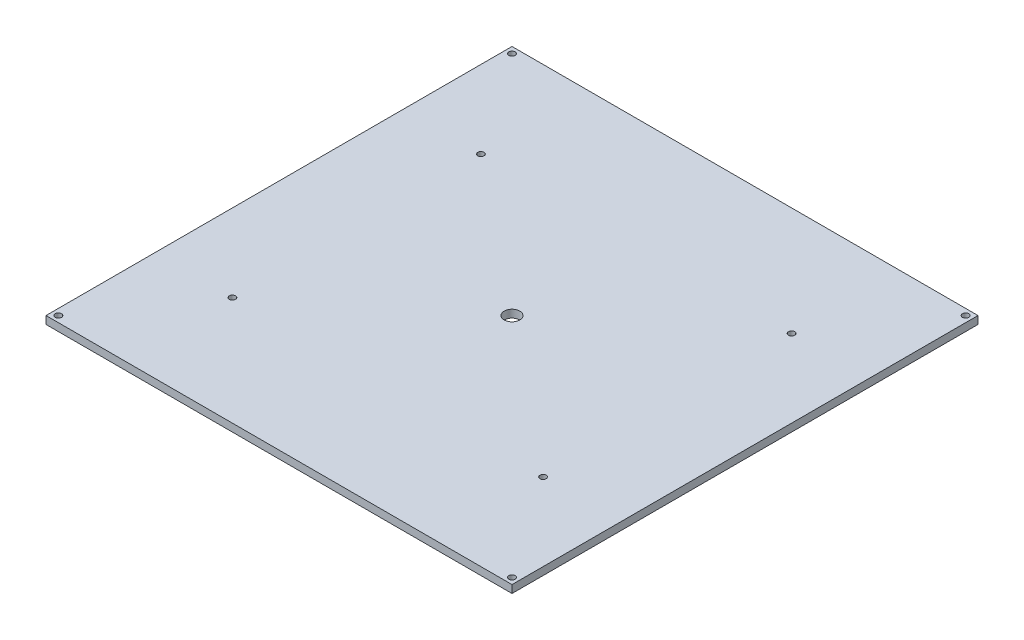
from build123d import *

# Parameters (mm, degrees)
SKETCH1_W                                  = 300
SKETCH1_H                                  = 300
BOSS_EXTRUDE1_DEPTH                        = 5
CUT_EXTRUDE1_REACH                         = 214.191
SKETCH2_R                                  = 2.05
MIRROR1_AT_THE_SECOND_PLANE_COPY_1_REACH   = 214.191
MIRROR1_AT_THE_SECOND_PLANE_COPY_1_SKETC_R = 2.05
CUT_EXTRUDE2_REACH                         = 214.191
SKETCH3_R                                  = 2
SKETCH3_R_2                                = 5


with BuildPart() as part:
    # Sketch1 → Boss-Extrude1 (new body)
    with BuildSketch(Plane(origin=(0, 0, 0), x_dir=(1, 0, 0), z_dir=(0, 1, 0))):
        Rectangle(SKETCH1_W, SKETCH1_H)
    extrude(amount=BOSS_EXTRUDE1_DEPTH)

    # Sketch2 → Cut-Extrude1 (cut, up to next)
    with BuildSketch(Plane(origin=(0, 5, 0), x_dir=(1, 0, 0), z_dir=(0, 1, 0)), mode=Mode.PRIVATE) as cut_extrude1_sk1:
        with Locations(Location((-146, 146, 0), (0, 0, 270))):
            Circle(SKETCH2_R)
    cut_extrude1_tool1 = extrude(cut_extrude1_sk1.sketch, amount=-CUT_EXTRUDE1_REACH, mode=Mode.PRIVATE) & part.part
    cut_extrude1 = cut_extrude1_tool1.solids().sort_by_distance((-146, 5, -146))[0]
    add(cut_extrude1, mode=Mode.SUBTRACT)

    # Mirror1: Cut-Extrude1 across plane
    add(cut_extrude1.mirror(Plane(origin=(0, 0, 0), x_dir=(0, 0, 1), z_dir=(1, 0, 0))), mode=Mode.SUBTRACT)

    # Mirror1 at the second plane: Cut-Extrude1 across plane
    add(cut_extrude1.mirror(Plane.XY), mode=Mode.SUBTRACT)

    # Mirror1 at the second plane copy 1 sketc → Mirror1 at the second plane copy 1 (cut, up to next)
    with BuildSketch(Plane(origin=(0, 5, 0), x_dir=(-1, 0, 0), z_dir=(0, 1, 0)), mode=Mode.PRIVATE) as mirror1_at_the_second_plane_copy_1_sk1:
        with Locations(Location((-146, 146, 0), (0, 0, 270))):
            Circle(MIRROR1_AT_THE_SECOND_PLANE_COPY_1_SKETC_R)
    mirror1_at_the_second_plane_copy_1_tool1 = extrude(mirror1_at_the_second_plane_copy_1_sk1.sketch, amount=-MIRROR1_AT_THE_SECOND_PLANE_COPY_1_REACH, mode=Mode.PRIVATE) & part.part
    add(mirror1_at_the_second_plane_copy_1_tool1.solids().sort_by_distance((146, 5, 146))[0], mode=Mode.SUBTRACT)

    # Sketch3 → Cut-Extrude2 (cut, up to next)
    with BuildSketch(Plane(origin=(0, 5, 0), x_dir=(1, 0, 0), z_dir=(0, 1, 0)), mode=Mode.PRIVATE) as cut_extrude2_sk1:
        with Locations(Location((-100, 80, 0), (0, 0, 270))):
            Circle(SKETCH3_R)
    cut_extrude2_tool1 = extrude(cut_extrude2_sk1.sketch, amount=-CUT_EXTRUDE2_REACH, mode=Mode.PRIVATE) & part.part
    # Sketch3 → Cut-Extrude2 (cut, up to next)
    with BuildSketch(Plane(origin=(0, 5, 0), x_dir=(1, 0, 0), z_dir=(0, 1, 0)), mode=Mode.PRIVATE) as cut_extrude2_sk2:
        with Locations(Location((100, 80, 0), (0, 0, 270))):
            Circle(SKETCH3_R)
    cut_extrude2_tool2 = extrude(cut_extrude2_sk2.sketch, amount=-CUT_EXTRUDE2_REACH, mode=Mode.PRIVATE) & part.part
    # Sketch3 → Cut-Extrude2 (cut, up to next)
    with BuildSketch(Plane(origin=(0, 5, 0), x_dir=(1, 0, 0), z_dir=(0, 1, 0)), mode=Mode.PRIVATE) as cut_extrude2_sk3:
        with Locations(Location((100, -80, 0), (0, 0, 270))):
            Circle(SKETCH3_R)
    cut_extrude2_tool3 = extrude(cut_extrude2_sk3.sketch, amount=-CUT_EXTRUDE2_REACH, mode=Mode.PRIVATE) & part.part
    # Sketch3 → Cut-Extrude2 (cut, up to next)
    with BuildSketch(Plane(origin=(0, 5, 0), x_dir=(1, 0, 0), z_dir=(0, 1, 0)), mode=Mode.PRIVATE) as cut_extrude2_sk4:
        with Locations(Location((-100, -80, 0), (0, 0, 270))):
            Circle(SKETCH3_R)
    cut_extrude2_tool4 = extrude(cut_extrude2_sk4.sketch, amount=-CUT_EXTRUDE2_REACH, mode=Mode.PRIVATE) & part.part
    # Sketch3 → Cut-Extrude2 (cut, up to next)
    with BuildSketch(Plane(origin=(0, 5, 0), x_dir=(1, 0, 0), z_dir=(0, 1, 0)), mode=Mode.PRIVATE) as cut_extrude2_sk5:
        with Locations(Location((0, 0, 0), (0, 0, 270))):
            Circle(SKETCH3_R_2)
    cut_extrude2_tool5 = extrude(cut_extrude2_sk5.sketch, amount=-CUT_EXTRUDE2_REACH, mode=Mode.PRIVATE) & part.part
    add(cut_extrude2_tool1.solids().sort_by_distance((-100, 5, -80))[0], mode=Mode.SUBTRACT)
    add(cut_extrude2_tool2.solids().sort_by_distance((100, 5, -80))[0], mode=Mode.SUBTRACT)
    add(cut_extrude2_tool3.solids().sort_by_distance((100, 5, 80))[0], mode=Mode.SUBTRACT)
    add(cut_extrude2_tool4.solids().sort_by_distance((-100, 5, 80))[0], mode=Mode.SUBTRACT)
    add(cut_extrude2_tool5.solids().sort_by_distance((0, 5, 0))[0], mode=Mode.SUBTRACT)


solid = part.part
